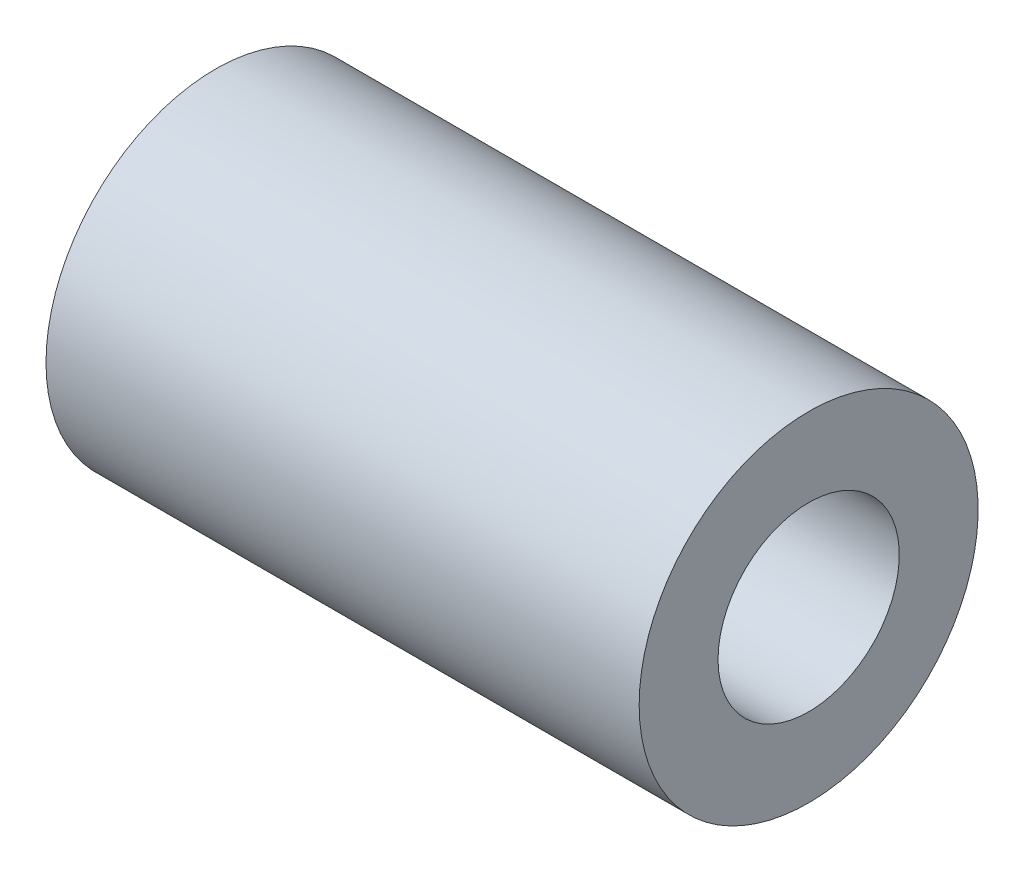
from build123d import *

# Parameters (mm, degrees)
CONN_T4_FNPT_SKETCH_W = 36
CONN_T4_FNPT_SKETCH_H = 10.287
SOCKET_1_SKETCH_W     = 15
SOCKET_1_SKETCH_H     = 5.5
SOCKET_2_SKETCH_W     = 16.2
SOCKET_2_SKETCH_H     = 3.175


with BuildPart() as part:
    # Conn_T4_FNPT Sketch → Conn_T4_FNPT (revolve)
    with BuildSketch(Plane.XY):
        with Locations((-18, 5.1435)):
            Rectangle(CONN_T4_FNPT_SKETCH_W, CONN_T4_FNPT_SKETCH_H)
    revolve(axis=Axis((-1000, 0, 0), (1, 0, 0)))

    # Socket 1 Sketch → Socket 1 (revolve, cut)
    with BuildSketch(Plane.XY):
        with Locations((-6.5, 2.75)):
            Rectangle(SOCKET_1_SKETCH_W, SOCKET_1_SKETCH_H)
    revolve(axis=Axis((-1000, 0, 0), (1, 0, 0)), mode=Mode.SUBTRACT)

    # Socket 2 Sketch → Socket 2 (revolve, cut)
    with BuildSketch(Plane.XY):
        with Locations((-28.9, 1.5875)):
            Rectangle(SOCKET_2_SKETCH_W, SOCKET_2_SKETCH_H)
    revolve(axis=Axis((-1000, 0, 0), (1, 0, 0)), mode=Mode.SUBTRACT)


solid = part.part
